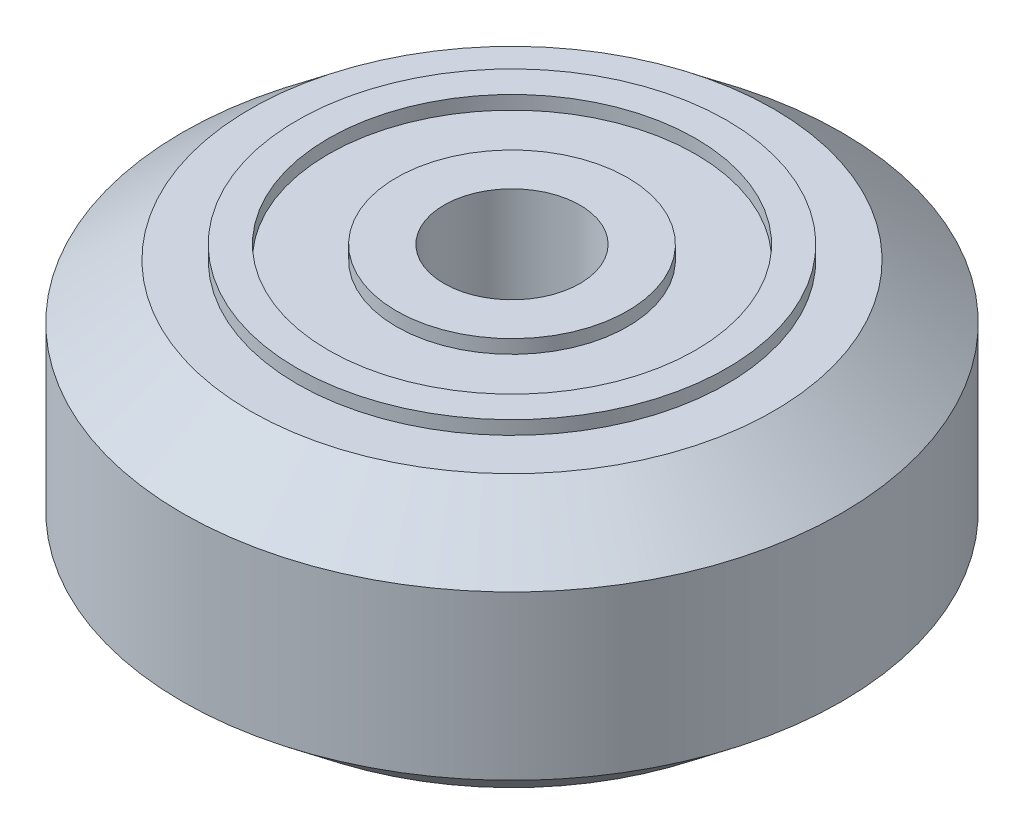
from build123d import *

# Parameters (mm, degrees)
SKETCH4_R           = 10.429730926
SKETCH4_R_2         = 7.9
CUT_EXTRUDE1_DEPTH  = 0.5
SKETCH5_R           = 6.75
CUT_EXTRUDE2_DEPTH  = 0.5
SKETCH6_R           = 4.25
BOSS_EXTRUDE1_DEPTH = 0.5
SKETCH7_R           = 2.5
CUT_EXTRUDE3_DEPTH  = 21.372315774


with BuildPart() as part:
    # Sketch1 → Revolve1 (revolve)
    with BuildSketch(Plane.XY, mode=Mode.PRIVATE) as revolve1_sk:
        Polygon((0, 0), (-8.999444444, 0), (-12.125, 2.5), (-12.125, 8.5), (-8.999444444, 11), (0, 11), align=None)
    revolve(revolve1_sk.sketch.rotate(Axis((0, 11, 0), (0, -1, 0)), 270), axis=Axis((0, 11, 0), (0, -1, 0)))

    # Sketch4 → Cut-Extrude1 (cut)
    with BuildSketch(Plane(origin=(0, 11, 0), x_dir=(1, 0, 0), z_dir=(0, 1, 0))):
        Circle(SKETCH4_R)
        with Locations(Location((0, 0, 0), (0, 0, 270))):
            Circle(SKETCH4_R_2, mode=Mode.SUBTRACT)
    cut_extrude1 = extrude(amount=-CUT_EXTRUDE1_DEPTH, mode=Mode.SUBTRACT)

    # Sketch5 → Cut-Extrude2 (cut)
    with BuildSketch(Plane(origin=(0, 11, 0), x_dir=(1, 0, 0), z_dir=(0, 1, 0))):
        with Locations(Location((0, 0, 0), (0, 0, 270))):
            Circle(SKETCH5_R)
    cut_extrude2 = extrude(amount=-CUT_EXTRUDE2_DEPTH, mode=Mode.SUBTRACT)

    # Sketch6 → Boss-Extrude1 (add)
    with BuildSketch(Plane(origin=(0, 10.5, 0), x_dir=(1, 0, 0), z_dir=(0, 1, 0))):
        with Locations(Location((0, 0, 0), (0, 0, 270))):
            Circle(SKETCH6_R)
    boss_extrude1 = extrude(amount=BOSS_EXTRUDE1_DEPTH)

    # Mirror1: Cut-Extrude1, Cut-Extrude2, Boss-Extrude1 across plane
    add(cut_extrude1.mirror(Plane.ZX.offset(5.5)), mode=Mode.SUBTRACT)
    add(cut_extrude2.mirror(Plane.ZX.offset(5.5)), mode=Mode.SUBTRACT)
    add(boss_extrude1.mirror(Plane.ZX.offset(5.5)))

    # Sketch7 → Cut-Extrude3 (cut, through all)
    with BuildSketch(Plane(origin=(0, 11, 0), x_dir=(1, 0, 0), z_dir=(0, 1, 0))):
        with Locations(Location((0, 0, 0), (0, 0, 270))):
            Circle(SKETCH7_R)
    extrude(amount=-CUT_EXTRUDE3_DEPTH, mode=Mode.SUBTRACT)


solid = part.part
